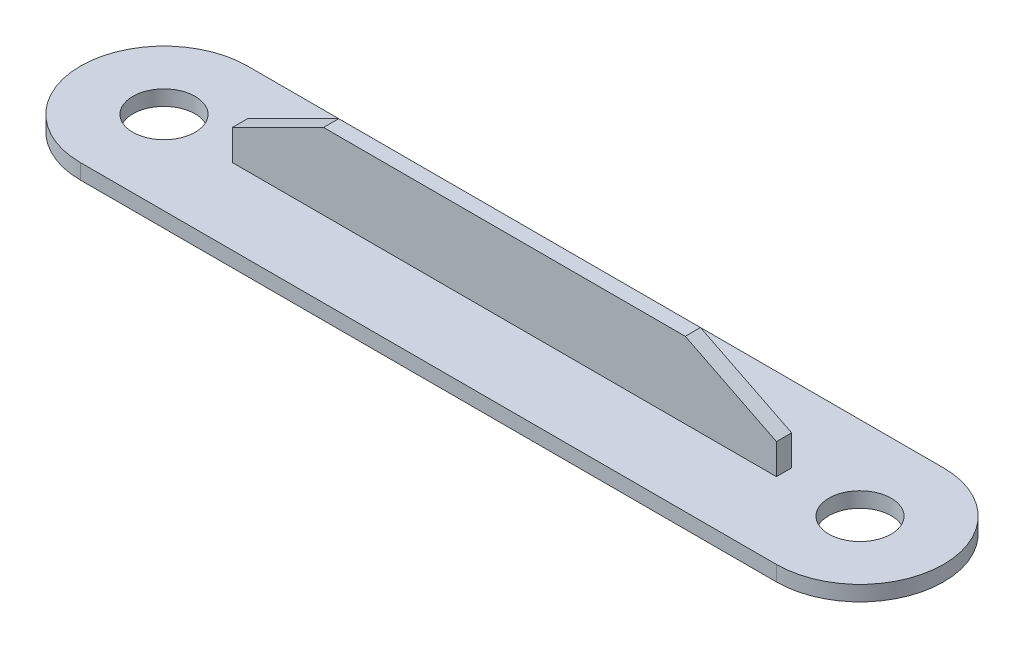
from build123d import *

# Parameters (mm, degrees)
SKETCH_4_R          = 20.5
EXTRUDE_4_DEPTH     = 10
SKETCH_5_W          = 358
SKETCH_5_H          = 10
EXTRUDE_5_DEPTH     = 50
CUT_EXTRUDE_1_DEPTH = 297.405128161


with BuildPart() as part:
    # 草图4 → 凸台-拉伸4 (new body)
    with BuildSketch(Plane(origin=(0, 0, 0), x_dir=(1, 0, 0), z_dir=(0, 1, 0))):
        with BuildLine():
            Line((-229, 55), (229, 55))
            ThreePointArc((229, 55), (284, 0), (229, -55))
            Line((229, -55), (-229, -55))
            ThreePointArc((-229, -55), (-284, 0), (-229, 55))
        make_face()
        with Locations(Location((-229, 0, 0), (0, 0, 270))):
            Circle(SKETCH_4_R, mode=Mode.SUBTRACT)
        with Locations(Location((229, 0, 0), (0, 0, 270))):
            Circle(SKETCH_4_R, mode=Mode.SUBTRACT)
    extrude(amount=EXTRUDE_4_DEPTH)

    # 草图5 → 凸台-拉伸5 (add)
    with BuildSketch(Plane(origin=(0, 10, 0), x_dir=(1, 0, 0), z_dir=(0, 1, 0))):
        Rectangle(SKETCH_5_W, SKETCH_5_H)
    extrude(amount=EXTRUDE_5_DEPTH)

    # 草图6 → 切除-拉伸1 (cut, through all)
    with BuildSketch(Plane.XY.offset(5)):
        Polygon((-179, 60), (-179, 30), (-119, 60), align=None)
        Polygon((179, 60), (179, 30), (119, 60), align=None)
    extrude(amount=-CUT_EXTRUDE_1_DEPTH, mode=Mode.SUBTRACT)


solid = part.part
